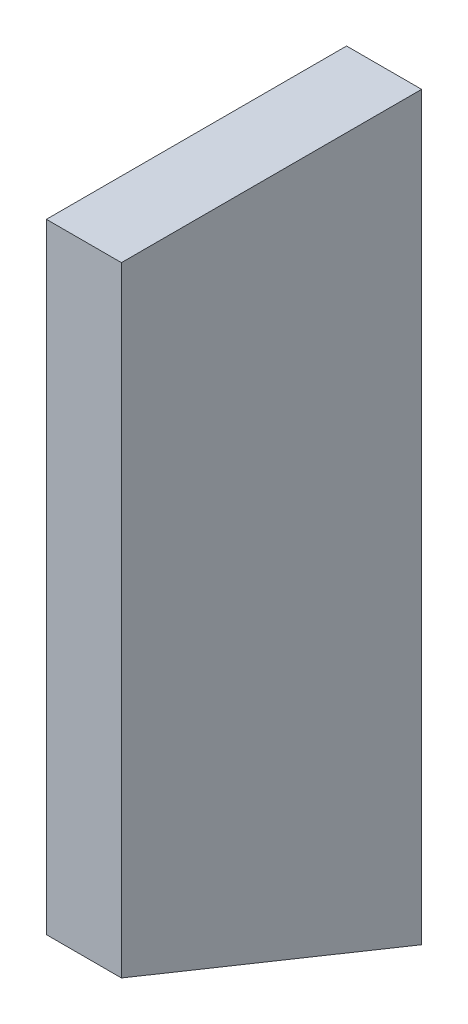
from build123d import *

# Parameters (mm, degrees)
BOSS_EXTRUDE1_DEPTH = 19.05


with BuildPart() as part:
    # Sketch2 → Boss-Extrude1 (new body)
    with BuildSketch(Plane.ZY.offset(-475.045949007)):
        Polygon((11.761380913, 6983.72999014), (-64.438619087, 6983.72999014), (-64.438619087, 6795.675878891), (11.761380913, 6826.4626773), align=None)
    extrude(amount=BOSS_EXTRUDE1_DEPTH)


solid = part.part
